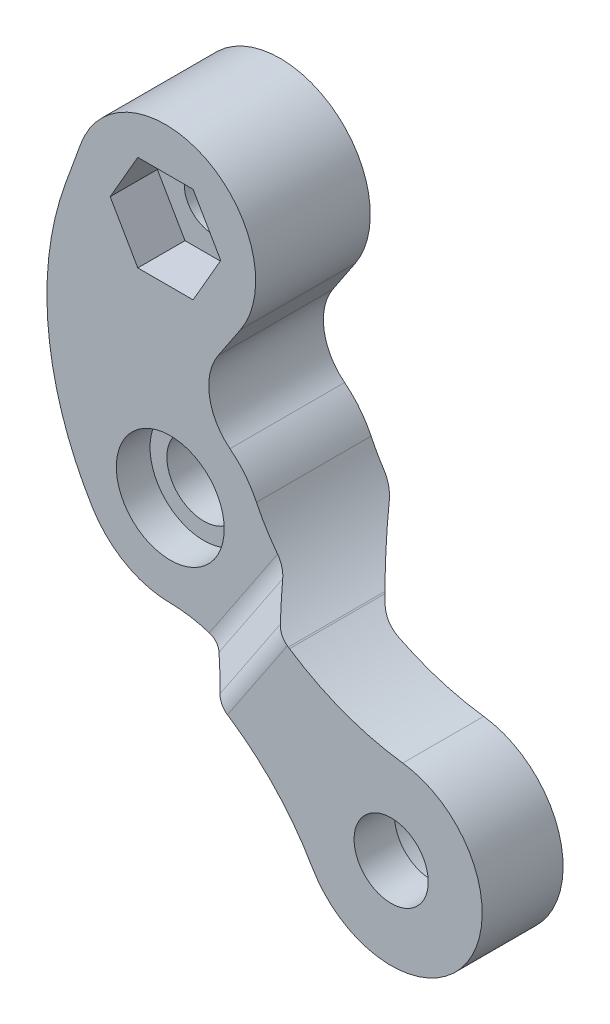
from build123d import *

# Parameters (mm, degrees)
SKETCH3_R               = 2.75
SKETCH3_R_2             = 2.1
BOSS_EXTRUDE2_DEPTH     = 11
CUT_EXTRUDE3_DEPTH      = 58.508197856
CUT_EXTRUDE3_DEPTH_BACK = 58.508197856
CUT_EXTRUDE5_DEPTH      = 91.859562292
CUT_EXTRUDE5_DEPTH_BACK = 3
SKETCH9_R               = 5
SKETCH10_R              = 5
CUT_EXTRUDE6_DEPTH      = 3
SKETCH11_R              = 4
CUT_EXTRUDE7_DEPTH      = 2.5
CUT_EXTRUDE8_DEPTH      = 2
CUT_EXTRUDE9_DEPTH      = 3.5


with BuildPart() as part:
    # Sketch3 → Boss-Extrude2 (new body)
    with BuildSketch(Plane.XY):
        with BuildLine():
            Line((11.81639044, 60.252883085), (11.728372068, 60.311638564))
            ThreePointArc((11.728372068, 60.311638564), (8.917204522, 62.7925154), (6.866230988, 65.931132995))
            ThreePointArc((6.866230988, 65.931132995), (6.025591445, 67.274340702), (4.901176311, 68.390840765))
            ThreePointArc((4.901176311, 68.390840765), (3.375934297, 70.989881123), (4.020351516, 73.93370524))
            Line((4.020351516, 73.93370524), (5.678869184, 76.41823992))
            ThreePointArc((5.678869184, 76.41823992), (3.137547336, 86.100651278), (-6.171856019, 82.420649156))
            Line((-6.171856019, 82.420649156), (-7.290261888, 79.347854286))
            ThreePointArc((-7.290261888, 79.347854286), (-8.557893098, 69.185727028), (-5.279809822, 59.483671095))
            ThreePointArc((-5.279809822, 59.483671095), (-2.848156457, 57.139360441), (0.414833066, 56.266646336))
            ThreePointArc((0.414833066, 56.266646336), (3.287818882, 55.822166382), (5.91364728, 54.574514525))
            Line((5.91364728, 54.574514525), (7.374782695, 53.599153256))
            ThreePointArc((7.374782695, 53.599153256), (10.815902262, 50.678650143), (13.499590609, 47.049812979))
            ThreePointArc((13.499590609, 47.049812979), (24.965953819, 46.665736496), (20.21385057, 57.108078892))
            ThreePointArc((20.21385057, 57.108078892), (15.833272198, 58.194897845), (11.81639044, 60.252883085))
        make_face()
        with Locations((19.351869275, 50.413343031)):
            Circle(SKETCH3_R, mode=Mode.SUBTRACT)
        with Locations((0.471910886, 63.016405008)):
            Circle(SKETCH3_R, mode=Mode.SUBTRACT)
        with Locations((0.114687614, 80.132534397)):
            Circle(SKETCH3_R_2, mode=Mode.SUBTRACT)
    extrude(amount=BOSS_EXTRUDE2_DEPTH)

    # Sketch8 → Cut-Extrude3 (cut, two sides: drawn at the far end of the back side and taken through both)
    with BuildSketch(Plane(origin=(31.465333136, 47.136495989, 0), x_dir=(0.8317162286287604, -0.5552009681507695, 0), z_dir=(0.5552009681507695, 0.8317162286287604, 0)).offset(-CUT_EXTRUDE3_DEPTH_BACK)):
        with BuildLine():
            Line((-28.1811996, -8.5), (-53.409946657, -8.5))
            Line((-53.409946657, -8.5), (-53.409946657, -11))
            Line((-53.409946657, -11), (-23.817856355, -11))
            ThreePointArc((-23.817856355, -11), (-24.442424101, -10.890774833), (-24.99285353, -10.576064729))
            Line((-24.99285353, -10.576064729), (-26.967564109, -8.937875854))
            ThreePointArc((-26.967564109, -8.937875854), (-27.536093723, -8.612816901), (-28.1811996, -8.5))
        make_face()
        with BuildLine():
            Line((-29.17758863, 0), (1.736877707, 0))
            Line((1.736877707, 0), (1.736877707, -5))
            Line((1.736877707, -5), (-21.22396203, -5))
            ThreePointArc((-21.22396203, -5), (-22.252174442, -4.820184962), (-23.158334542, -4.302084505))
            Line((-23.158334542, -4.302084505), (-27.702732311, -0.532123504))
            ThreePointArc((-27.702732311, -0.532123504), (-28.393631267, -0.137099418), (-29.17758863, 0))
        make_face()
    extrude(amount=CUT_EXTRUDE3_DEPTH + CUT_EXTRUDE3_DEPTH_BACK, mode=Mode.SUBTRACT)

    # Sketch9 → Cut-Extrude5 (cut, two sides: drawn at the far end of the back side and taken through both)
    with BuildSketch(Plane(origin=(0, 0, 5), x_dir=(-1, 0, 0), z_dir=(0, 0, -1)).offset(-CUT_EXTRUDE5_DEPTH_BACK)):
        with Locations(Location((-19.351869275, 50.413343031, 0), (0, 0, 180))):
            Circle(SKETCH9_R)
    extrude(amount=CUT_EXTRUDE5_DEPTH + CUT_EXTRUDE5_DEPTH_BACK, mode=Mode.SUBTRACT)

    # Sketch10 → Cut-Extrude6 (cut)
    with BuildSketch(Plane(origin=(0, 0, 0), x_dir=(-1, 0, 0), z_dir=(0, 0, -1))):
        with Locations((-0.471910886, 63.016405008)):
            Circle(SKETCH10_R)
    extrude(amount=-CUT_EXTRUDE6_DEPTH, mode=Mode.SUBTRACT)

    # Sketch11 → Cut-Extrude7 (cut)
    with BuildSketch(Plane.XY.offset(8.5)):
        with Locations((0.471910886, 63.016405008)):
            Circle(SKETCH11_R)
    extrude(amount=-CUT_EXTRUDE7_DEPTH, mode=Mode.SUBTRACT)

    # Sketch12 → Cut-Extrude8 (cut)
    with BuildSketch(Plane(origin=(0, 0, 0), x_dir=(-1, 0, 0), z_dir=(0, 0, -1))):
        with BuildLine():
            Line((3.691805092, 81.907531096), (4.579303441, 80.004284743))
            ThreePointArc((4.579303441, 80.004284743), (2.547807435, 74.422795339), (-3.03368197, 76.454291345))
            Line((-3.03368197, 76.454291345), (-3.92118032, 78.357537698))
            ThreePointArc((-3.92118032, 78.357537698), (-1.889684313, 83.939027102), (3.691805092, 81.907531096))
        make_face()
    extrude(amount=-CUT_EXTRUDE8_DEPTH, mode=Mode.SUBTRACT)

    # Sketch7 → Cut-Extrude9 (cut)
    with BuildSketch(Plane.XY.offset(8.5)):
        Polygon((2.16428107, 76.582534397), (4.213874525, 80.132534397), (2.16428107, 83.682534397), (-1.934905842, 83.682534397), (-3.984499297, 80.132534397), (-1.934905842, 76.582534397), align=None)
    extrude(amount=-CUT_EXTRUDE9_DEPTH, mode=Mode.SUBTRACT)


solid = part.part
